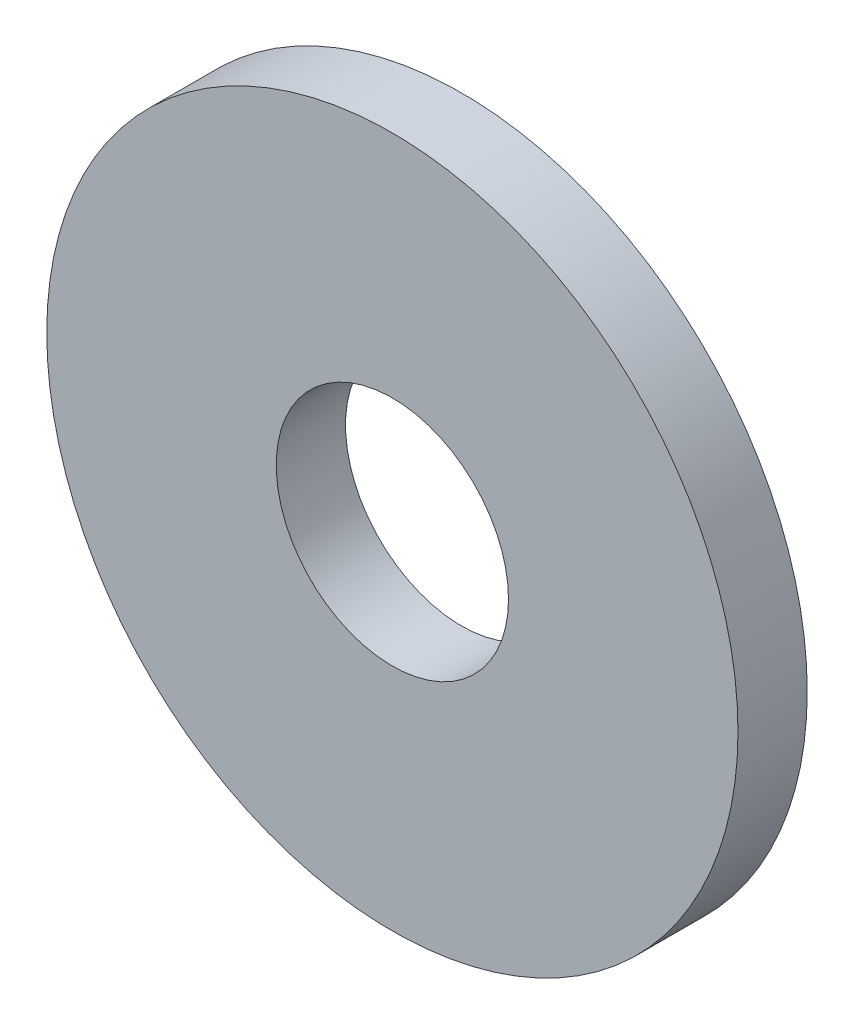
from build123d import *

# Parameters (mm, degrees)
SKETCH_1_R      = 14.97
SKETCH_1_R_2    = 5.03
EXTRUDE_1_DEPTH = 3


with BuildPart() as part:
    # 草图1 → 凸台-拉伸1 (new body)
    with BuildSketch(Plane.XY):
        Circle(SKETCH_1_R)
        Circle(SKETCH_1_R_2, mode=Mode.SUBTRACT)
    extrude(amount=EXTRUDE_1_DEPTH)


solid = part.part
